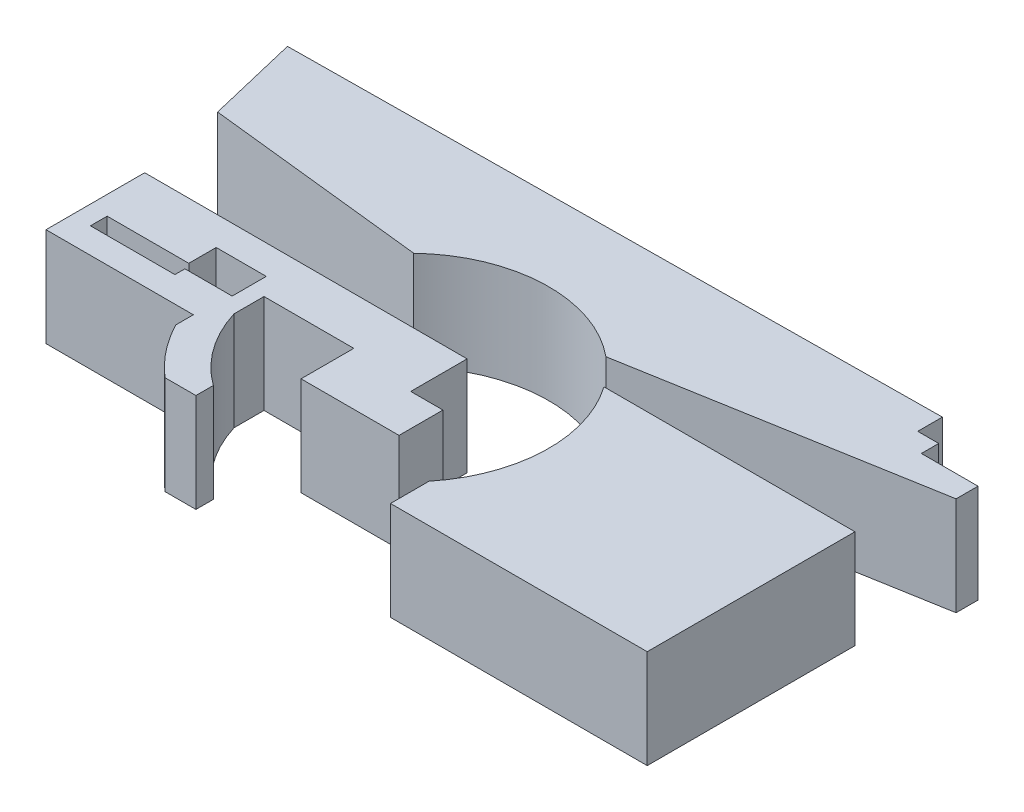
from build123d import *

# Parameters (mm, degrees)
EXTRUDE_1_DEPTH   = 30
EXTRUDE_1_2_DEPTH = 30
EXTRUDE_1_3_DEPTH = 30


with BuildPart() as part:
    # 草图1 → 凸台-拉伸1 (new body)
    with BuildSketch(Plane(origin=(0, 0, 0), x_dir=(1, 0, 0), z_dir=(0, 1, 0))):
        with BuildLine():
            Line((-136.082892291, 54.969018568), (61.05573215, 56.912638809))
            Line((61.05573215, 56.912638809), (61.05573215, 49.41581788))
            Line((61.05573215, 49.41581788), (67.441912941, 49.41581788))
            Line((67.441912941, 49.41581788), (67.441912941, 44.140277226))
            Line((67.441912941, 44.140277226), (84.656835076, 44.140277226))
            Line((84.656835076, 44.140277226), (84.656835076, 37.4764364))
            Line((84.656835076, 37.4764364), (-5.980957684, 21.667519058))
            ThreePointArc((-5.980957684, 21.667519058), (-34.577933368, 31.396492976), (-62.426846885, 19.697007186))
            Line((-62.426846885, 19.697007186), (-129.419051465, 27.064185109))
            Line((-129.419051465, 27.064185109), (-136.082892291, 54.969018568))
        make_face()
    extrude(amount=EXTRUDE_1_DEPTH)


with BuildPart() as body_2:
    # 草图1 → Extrude 1 2 (new body)
    with BuildSketch(Plane(origin=(0, 0, 0), x_dir=(1, 0, 0), z_dir=(0, 1, 0))):
        with BuildLine():
            Line((-102.031983165, 0), (-26.508453802, 0))
            Line((-26.508453802, 0), (-26.508453802, -17.142864306))
            Line((-26.508453802, -17.142864306), (-16.713074962, -17.142864306))
            Line((-16.713074962, -17.142864306), (-16.713074962, -30.490830167))
            Line((-16.713074962, -30.490830167), (-46.49997628, -30.490830167))
            Line((-46.49997628, -30.490830167), (-46.49997628, -14.450076067))
            Line((-46.49997628, -14.450076067), (-73.791928581, -14.450076067))
            Line((-73.791928581, -14.450076067), (-73.791928581, -23.563516851))
            ThreePointArc((-73.791928581, -23.563516851), (-67.732334309, -35.851817062), (-58.082020963, -45.577682428))
            Line((-58.082020963, -45.577682428), (-58.082020963, -50.869114449))
            Line((-58.082020963, -50.869114449), (-67.488115693, -50.869114449))
            ThreePointArc((-67.488115693, -50.869114449), (-74.342116157, -43.698394408), (-79.726627066, -35.36751267))
            Line((-79.726627066, -35.36751267), (-79.726627066, -29.999037995))
            Line((-79.726627066, -29.999037995), (-102.031983165, -29.999037995))
            Line((-102.031983165, -29.999037995), (-124.522445953, -29.999037995))
            Line((-124.522445953, -29.999037995), (-124.522445953, 0))
            Line((-124.522445953, 0), (-102.031983165, 0))
        make_face()
        Polygon((-118.789920471, -17.142864306), (-93.974323171, -17.142864306), (-93.974323171, -8.812593797), (-78.750035691, -8.812593797), (-78.750035691, -19.183087669), (-93.11257105, -19.183087669), (-93.11257105, -22.224557031), (-118.789920471, -22.224557031), align=None, mode=Mode.SUBTRACT)
    extrude(amount=EXTRUDE_1_2_DEPTH)


with BuildPart() as body_3:
    # 草图1 → Extrude 1 3 (new body)
    with BuildSketch(Plane(origin=(0, 0, 0), x_dir=(1, 0, 0), z_dir=(0, 1, 0))):
        with BuildLine():
            Line((1.651741835, 13.437845981), (77.955850579, 13.437845981))
            Line((77.955850579, 13.437845981), (77.955850579, -49.712900439))
            Line((77.955850579, -49.712900439), (-0.084706025, -49.712900439))
            Line((-0.084706025, -49.712900439), (-0.084706025, -37.99037163))
            ThreePointArc((-0.084706025, -37.99037163), (9.437334696, -12.568454589), (1.651741835, 13.437845981))
        make_face()
    extrude(amount=EXTRUDE_1_3_DEPTH)


solid = Compound([part.part, body_2.part, body_3.part])
